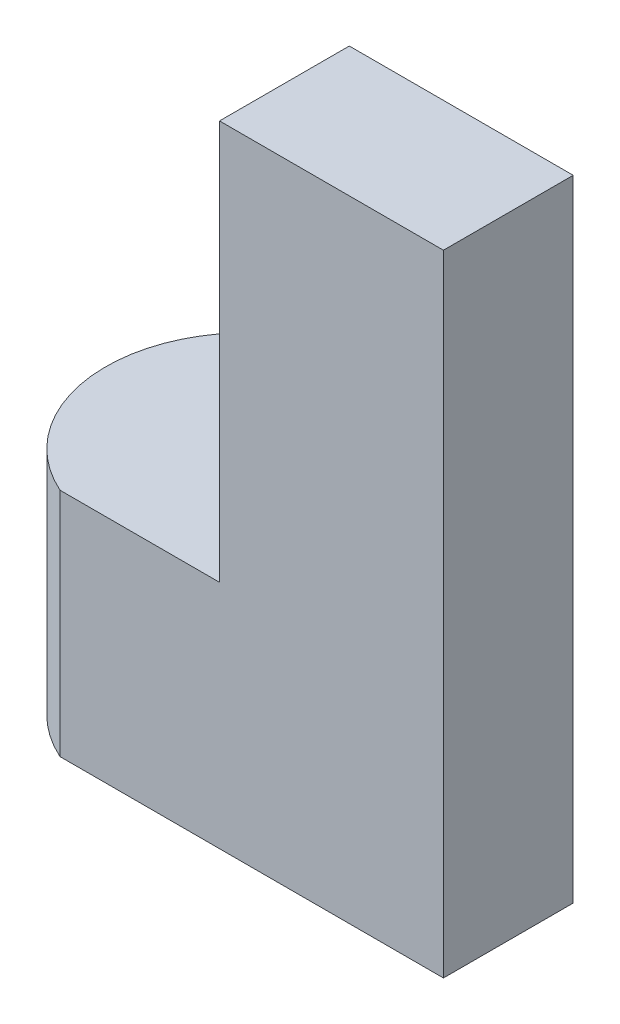
from build123d import *

# Parameters (mm, degrees)
EXTRUDE_1_DEPTH     = 170
SKETCH_3_W          = 66.248134628
SKETCH_3_H          = 139.711623237
CUT_EXTRUDE_1_DEPTH = 170


with BuildPart() as part:
    # 草图1 → 凸台-拉伸1 (new body)
    with BuildSketch(Plane(origin=(0, 0, 0), x_dir=(1, 0, 0), z_dir=(0, 1, 0))):
        with BuildLine():
            Line((-25.11018553, 16.026132479), (38.850953275, 16.026132479))
            Line((38.850953275, 16.026132479), (38.850953275, -18.973867521))
            Line((38.850953275, -18.973867521), (-64.562961279, -18.973867521))
            ThreePointArc((-64.562961279, -18.973867521), (-81.696259365, 35.906986737), (-25.11018553, 46.079219305))
            Line((-25.11018553, 46.079219305), (-25.11018553, 16.026132479))
        make_face()
    extrude(amount=EXTRUDE_1_DEPTH)

    # 草图3 → 切除-拉伸1 (cut)
    with BuildSketch(Plane.XY.offset(18.973867521)):
        with Locations((-54.667445772, 132.083845768)):
            Rectangle(SKETCH_3_W, SKETCH_3_H)
    extrude(amount=-CUT_EXTRUDE_1_DEPTH, mode=Mode.SUBTRACT)


solid = part.part
